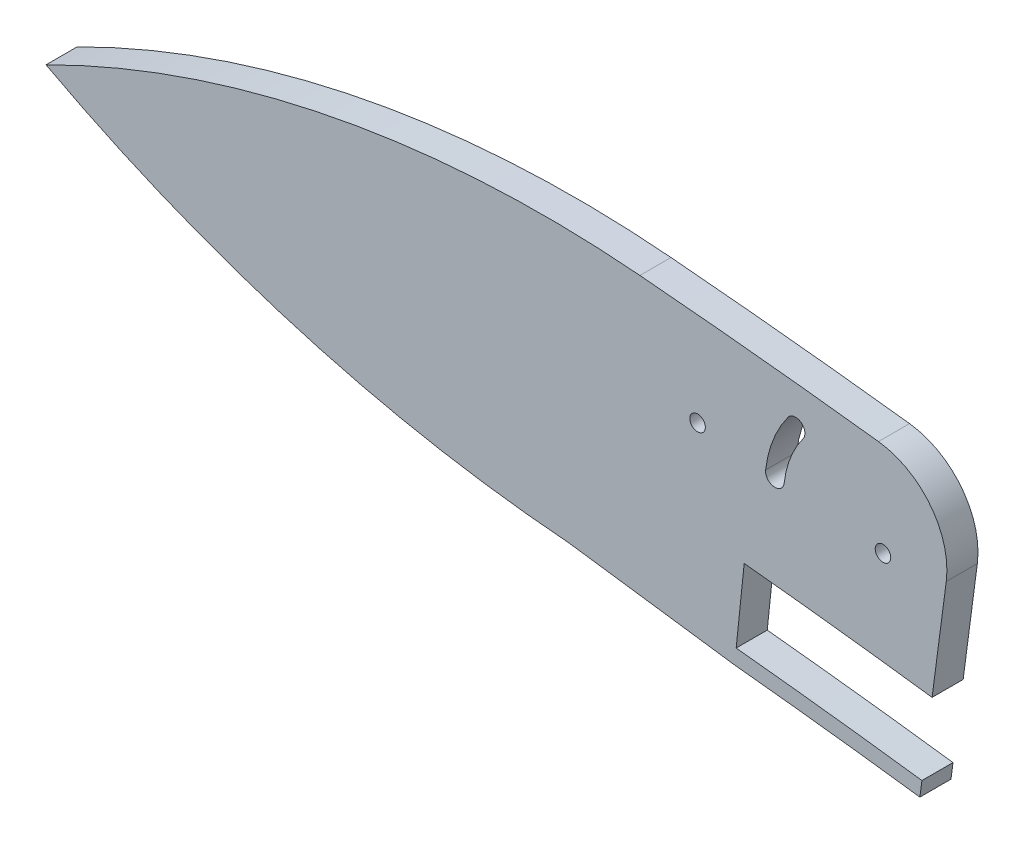
from build123d import *

# Parameters (mm, degrees)
P_IDAT_VYSUNUT_M1_DEPTH             = 1
SKICA3_R                            = 0.5
ODEBRAT_VYSUNUT_M1_DEPTH            = 64.02628038
ODEBRAT_VYSUNUT_M2_DEPTH            = 64.02628038
ODEBRAT_VYSUNUT_M2_DEPTH_BACK       = 64.02628038
P_IDAT_VYSUNUT_M2_REACH             = 64.499
P_IDAT_VYSUNUT_M2_DIRECTION_2_REACH = 64.499
ZAOBLIT1_R                          = 5


with BuildPart() as part:
    # Skica2 → Přidat vysunutím1 (new, symmetric)
    with BuildSketch(Plane.XY):
        with BuildLine():
            Line((58.568883798, -5.84497543), (56.281036775, -23.194781077))
            ThreePointArc((56.281036775, -23.194781077), (44.962038089, -21.854387935), (33.611521044, -20.814124588))
            ThreePointArc((33.611521044, -20.814124588), (16.298701423, -17.643643834), (0, -11))
            ThreePointArc((0, -11), (18.591127375, -4.663998517), (38.205152177, -3.63202809))
            ThreePointArc((38.205152177, -3.63202809), (48.399667289, -4.622101799), (58.568883798, -5.84497543))
        make_face()
    extrude(amount=P_IDAT_VYSUNUT_M1_DEPTH, both=True)

    # Skica3 → Odebrat vysunutím1 (cut, through all)
    with BuildSketch(Plane.XY.offset(1)):
        with Locations((41.913528916, -9.991754516)):
            Circle(SKICA3_R)
        with Locations((53.842906505, -11.291735411)):
            Circle(SKICA3_R)
        with BuildLine():
            ThreePointArc((47.737008304, -6.766472197), (46.773837436, -8.500989544), (46.292411943, -10.42569161))
            ThreePointArc((46.292411943, -10.42569161), (46.82013174, -11.090155165), (47.484595295, -10.562435368))
            ThreePointArc((47.484595295, -10.562435368), (47.890006236, -8.941633628), (48.701097493, -7.480987442))
            ThreePointArc((48.701097493, -7.480987442), (48.576310521, -6.641685225), (47.737008304, -6.766472197))
        make_face()
    extrude(amount=-ODEBRAT_VYSUNUT_M1_DEPTH, mode=Mode.SUBTRACT)

    # Skica4 → Odebrat vysunutím2 (cut, two sides: drawn at the far end of the back side and taken through both)
    with BuildSketch(Plane.XY.offset(1).offset(-ODEBRAT_VYSUNUT_M2_DEPTH_BACK)):
        with BuildLine():
            Line((44.91326279, -16.319473776), (44.346696401, -21.790214359))
            ThreePointArc((44.346696401, -21.790214359), (50.318767602, -22.450854723), (56.281036775, -23.194781077))
            Line((56.281036775, -23.194781077), (57.000074411, -17.741985017))
            ThreePointArc((57.000074411, -17.741985017), (50.961632228, -16.988554377), (44.91326279, -16.319473776))
        make_face()
    extrude(amount=ODEBRAT_VYSUNUT_M2_DEPTH + ODEBRAT_VYSUNUT_M2_DEPTH_BACK, mode=Mode.SUBTRACT)

    # Přidat vysunutím2: up to this face of the body (flat: up to its plane)
    p_idat_vysunut_m2_end = Plane(part.part.faces().sort_by_distance((32.156276153, -11.702089795, 1))[0])
    # Skica5 → Přidat vysunutím2 (add, up to the picked face)
    with BuildSketch(Plane.XY, mode=Mode.PRIVATE) as p_idat_vysunut_m2_sk1:
        with BuildLine():
            Line((33.611521044, -20.814124588), (44.295190366, -22.287554412))
            ThreePointArc((44.295190366, -22.287554412), (50.260325363, -22.947427482), (56.215669717, -23.69048981))
            Line((56.215669717, -23.69048981), (56.346403833, -22.699072345))
            ThreePointArc((56.346403833, -22.699072345), (50.37720984, -21.954281964), (44.398202436, -21.292874306))
            Line((44.398202436, -21.292874306), (44.346696401, -21.790214359))
            ThreePointArc((44.346696401, -21.790214359), (38.982163929, -21.268567871), (33.611521044, -20.814124588))
        make_face()
    p_idat_vysunut_m2_tool1 = split(extrude(p_idat_vysunut_m2_sk1.sketch, amount=P_IDAT_VYSUNUT_M2_REACH, mode=Mode.PRIVATE), bisect_by=p_idat_vysunut_m2_end, keep=Keep.BOTH, mode=Mode.PRIVATE)
    add(p_idat_vysunut_m2_tool1.solids().sort_by(Axis((48.409605, -22.295213, 0), (0, 0, 1)))[0])

    # Přidat vysunutím2 direction 2: up to this face of the body (flat: up to its plane)
    p_idat_vysunut_m2_direction_2_end = Plane(part.part.faces().sort_by_distance((32.156276153, -11.702089795, -1))[0])
    # Skica5 → Přidat vysunutím2 direction 2 (add, up to the picked face)
    with BuildSketch(Plane.XY, mode=Mode.PRIVATE) as p_idat_vysunut_m2_direction_2_sk1:
        with BuildLine():
            Line((33.611521044, -20.814124588), (44.295190366, -22.287554412))
            ThreePointArc((44.295190366, -22.287554412), (50.260325363, -22.947427482), (56.215669717, -23.69048981))
            Line((56.215669717, -23.69048981), (56.346403833, -22.699072345))
            ThreePointArc((56.346403833, -22.699072345), (50.37720984, -21.954281964), (44.398202436, -21.292874306))
            Line((44.398202436, -21.292874306), (44.346696401, -21.790214359))
            ThreePointArc((44.346696401, -21.790214359), (38.982163929, -21.268567871), (33.611521044, -20.814124588))
        make_face()
    p_idat_vysunut_m2_direction_2_tool1 = split(extrude(p_idat_vysunut_m2_direction_2_sk1.sketch, amount=-P_IDAT_VYSUNUT_M2_DIRECTION_2_REACH, mode=Mode.PRIVATE), bisect_by=p_idat_vysunut_m2_direction_2_end, keep=Keep.BOTH, mode=Mode.PRIVATE)
    add(p_idat_vysunut_m2_direction_2_tool1.solids().sort_by(Axis((48.409605, -22.295213, 0), (0, 0, -1)))[0])

    # Zaoblit1
    zaoblit1_edges = [part.edges().sort_by_distance(p)[0] for p in [
        (58.568883798, -5.84497543, 0),
    ]]
    fillet(zaoblit1_edges, radius=ZAOBLIT1_R)


solid = part.part
